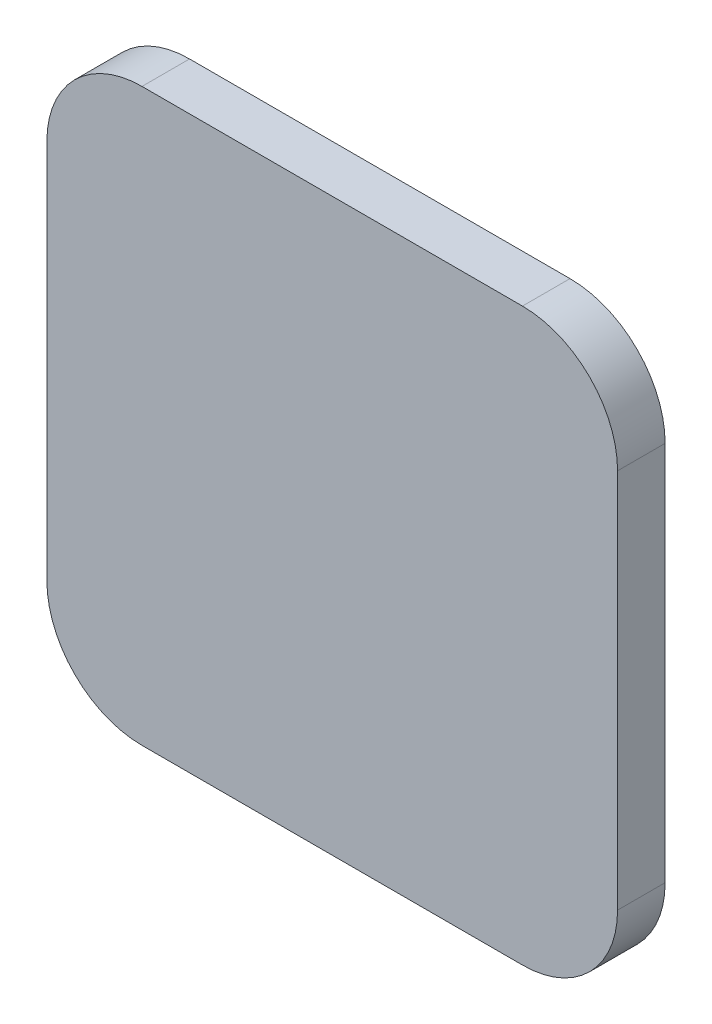
from build123d import *

# Parameters (mm, degrees)
SKETCH1_R           = 7.5
SKETCH1_R_2         = 5
BOSS_EXTRUDE1_DEPTH = 5
SKETCH2_W           = 30
SKETCH2_H           = 30
BOSS_EXTRUDE2_DEPTH = 2.5
FILLET1_R           = 5
FILLET2_R           = 1.3


with BuildPart() as part:
    # Sketch1 → Boss-Extrude1 (new body)
    with BuildSketch(Plane.XY):
        Circle(SKETCH1_R)
        Circle(SKETCH1_R_2, mode=Mode.SUBTRACT)
    extrude(amount=BOSS_EXTRUDE1_DEPTH)

    # Sketch2 → Boss-Extrude2 (add)
    with BuildSketch(Plane.XY.offset(5)):
        Rectangle(SKETCH2_W, SKETCH2_H)
    extrude(amount=BOSS_EXTRUDE2_DEPTH)

    # Fillet1
    fillet1_edges = [part.edges().sort_by_distance(p)[0] for p in [
        (15, -15, 6.25),
        (15, 15, 6.25),
        (-15, 15, 6.25),
        (-15, -15, 6.25),
    ]]
    fillet(fillet1_edges, radius=FILLET1_R)

    # Fillet2
    fillet2_edges = [part.edges().sort_by_distance(p)[0] for p in [
        (-7.5, 0, 5),
    ]]
    fillet(fillet2_edges, radius=FILLET2_R)


solid = part.part
